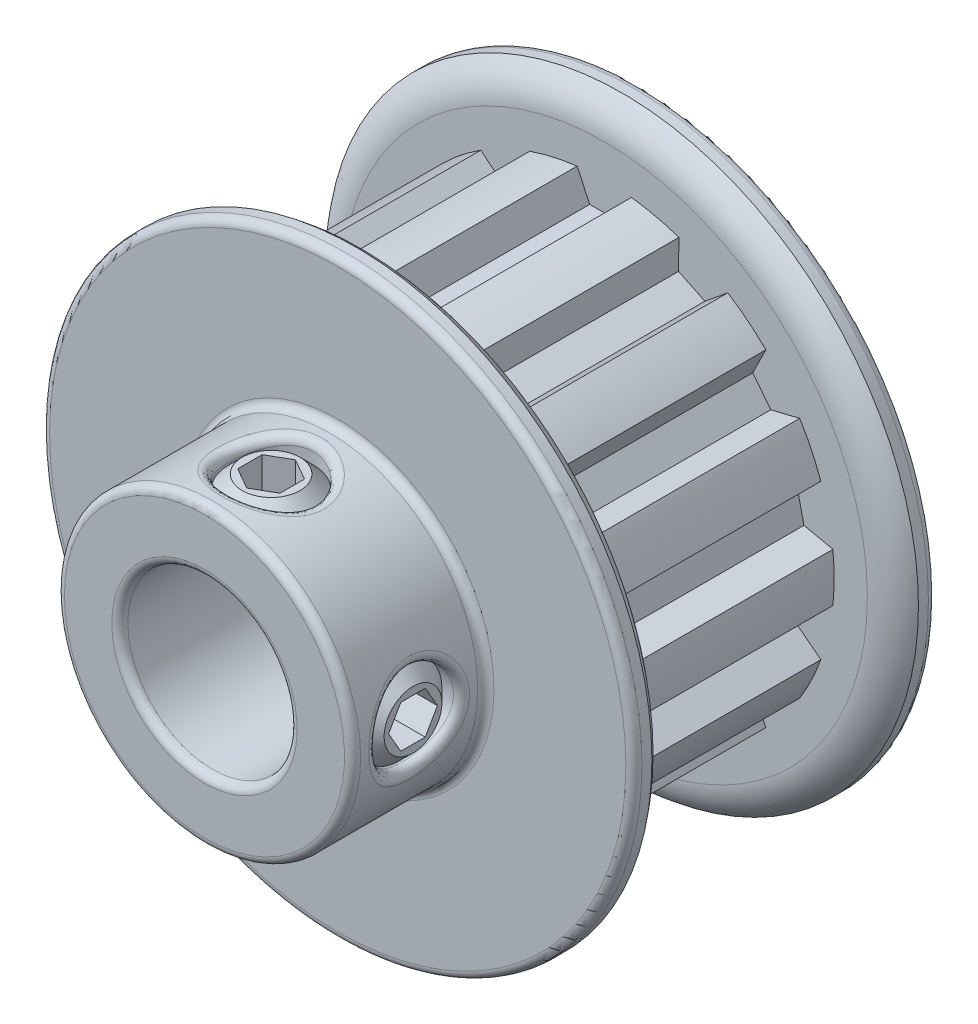
from build123d import *

# Parameters (mm, degrees)
CUT_EXTRUDE1_START = 2.3
CUT_EXTRUDE1_DEPTH = 10.9
CIRPATTERN1_COUNT  = 14
SKETCH4_R          = 2
CUT_EXTRUDE2_DEPTH = 23.317930012
CUT_EXTRUDE3_DEPTH = 1.5
CIRPATTERN2_COUNT  = 2
CIRPATTERN2_ANGLE  = 90
FILLET1_R          = 0.381


with BuildPart() as part:
    # Sketch2 → Revolve1 (revolve)
    with BuildSketch(Plane(origin=(0, 0, 0), x_dir=(0, 0, -1), z_dir=(1, 0, 0)), mode=Mode.PRIVATE) as revolve1_sk:
        with BuildLine():
            Line((-10.3, 4), (10.3, 4))
            Line((10.3, 4), (10.3, 14))
            Line((10.3, 14), (9.45, 14))
            ThreePointArc((9.45, 14), (8.82619825, 13.324895439), (8.6, 12.433980661))
            Line((8.6, 12.433980661), (8.6, 10.867961322))
            Line((8.6, 10.867961322), (-2.3, 10.867961322))
            Line((-2.3, 10.867961322), (-2.3, 12.433980661))
            ThreePointArc((-2.3, 12.433980661), (-2.52619825, 13.324895439), (-3.15, 14))
            Line((-3.15, 14), (-4, 14))
            Line((-4, 14), (-4, 7))
            Line((-4, 7), (-10.3, 7))
            Line((-10.3, 7), (-10.3, 4))
        make_face()
    revolve(revolve1_sk.sketch.rotate(Axis((0, 0, 10.3), (0, 0, -1)), 90), axis=Axis((0, 0, 10.3), (0, 0, -1)))

    # Sketch3 → Cut-Extrude1 (cut)
    with BuildSketch(Plane.XY.offset(CUT_EXTRUDE1_START)):
        with BuildLine():
            Line((-0.690489274, 9.522), (0.690489274, 9.522))
            Line((0.690489274, 9.522), (1.2827, 10.792))
            ThreePointArc((1.2827, 10.792), (0, 10.867961322), (-1.2827, 10.792))
            Line((-1.2827, 10.792), (-0.690489274, 9.522))
        make_face()
    cut_extrude1 = extrude(amount=-CUT_EXTRUDE1_DEPTH, mode=Mode.SUBTRACT)

    # CirPattern1: Cut-Extrude1 ×14 about axis
    cirpattern1_axis = Axis((0, 0, 0), (0, 0, 1))
    for i in range(1, CIRPATTERN1_COUNT):
        add(cut_extrude1.rotate(cirpattern1_axis, i * 360 / CIRPATTERN1_COUNT), mode=Mode.SUBTRACT)

    # Sketch4 → Cut-Extrude2 (cut, through all)
    with BuildSketch(Plane(origin=(0, 0, 0), x_dir=(1, 0, 0), z_dir=(0, 1, 0))):
        with Locations(Location((0, -7.15, 0), (0, 0, 90))):
            Circle(SKETCH4_R)
    cut_extrude2 = extrude(amount=CUT_EXTRUDE2_DEPTH, mode=Mode.SUBTRACT)

    # Sketch5 → Revolve2 (revolve)
    with BuildSketch(Plane.XY.offset(7.15), mode=Mode.PRIVATE) as revolve2_sk:
        Polygon((0, 6.708203932), (0, 4), (-1.365, 4), (-2, 4.635), (-2, 6.073203932), (-1.365, 6.708203932), align=None)
    revolve2 = revolve(revolve2_sk.sketch.rotate(Axis((0, 0, 7.15), (0, 1, 0)), 270), axis=Axis((0, 0, 7.15), (0, 1, 0)))

    # Sketch6 → Cut-Extrude3 (cut)
    with BuildSketch(Plane(origin=(0, 6.708203932, 0), x_dir=(-1, 0, 0), z_dir=(0, -1, 0))):
        Polygon((0, -5.995299462), (-1, -6.572649731), (-1, -7.727350269), (0, -8.304700538), (1, -7.727350269), (1, -6.572649731), align=None)
    cut_extrude3 = extrude(amount=CUT_EXTRUDE3_DEPTH, mode=Mode.SUBTRACT)

    # CirPattern2: Cut-Extrude2, Revolve2, Cut-Extrude3 ×2 about axis
    cirpattern2_axis = Axis((0, 0, 0), (0, 0, -1))
    add([cut_extrude2.rotate(cirpattern2_axis, i * CIRPATTERN2_ANGLE / (CIRPATTERN2_COUNT - 1)) for i in range(1, CIRPATTERN2_COUNT)], mode=Mode.SUBTRACT)
    add([revolve2.rotate(cirpattern2_axis, i * CIRPATTERN2_ANGLE / (CIRPATTERN2_COUNT - 1)) for i in range(1, CIRPATTERN2_COUNT)])
    add([cut_extrude3.rotate(cirpattern2_axis, i * CIRPATTERN2_ANGLE / (CIRPATTERN2_COUNT - 1)) for i in range(1, CIRPATTERN2_COUNT)], mode=Mode.SUBTRACT)

    # Fillet1
    fillet1_edges = [part.edges().sort_by_distance(p)[0] for p in [
        (-14, 0, -10.3),
        (-4, 0, -10.3),
        (-4, 0, 10.3),
        (-1e-09, 6.999999991, 9.150000016),
        (6.708203932, -2, 7.15),
        (-7, 0, 10.3),
        (-7, 0, 4),
        (-14, 0, 4),
    ]]
    fillet(fillet1_edges, radius=FILLET1_R)


solid = part.part
